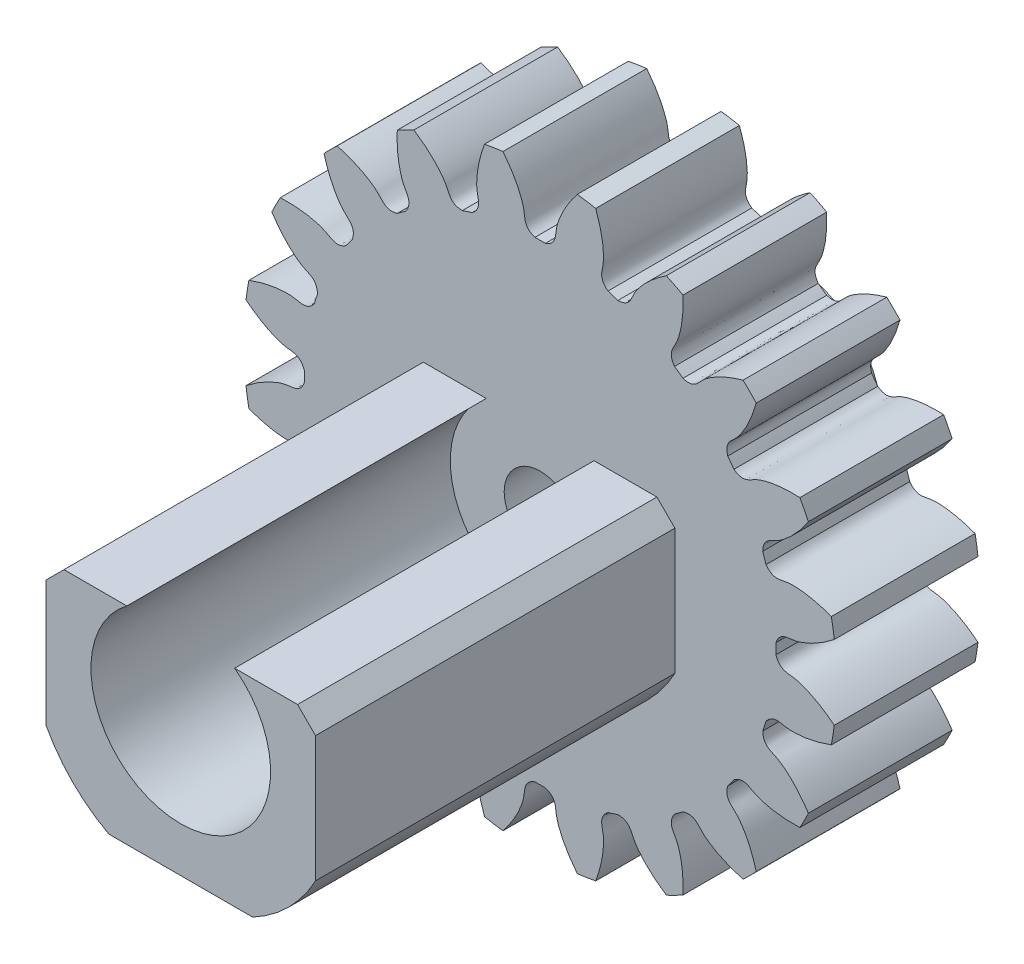
from build123d import *

# Parameters (mm, degrees)
SKETCH_1_R               = 16.5
EXTRUDE_1_DEPTH          = 8
CUT_EXTRUDE_1_DEPTH      = 25.667792767
PATTERN_CIRCULAR_1_COUNT = 20
SKETCH_4_R               = 6
EXTRUDE_2_DEPTH          = 1
SKETCH_5_R               = 5
EXTRUDE_3_DEPTH          = 5
SKETCH_6_R               = 8.5
EXTRUDE_4_DEPTH          = 20
SKETCH_7_R               = 5
CUT_EXTRUDE_2_DEPTH      = 20
SKETCH_8_W               = 20.681346225
SKETCH_8_H               = 7.878608086
CUT_EXTRUDE_3_DEPTH      = 20
CUT_EXTRUDE_START        = -20
CUT_EXTRUDE_4_DEPTH      = 20
CHAMFER_1_SIZE           = 1
SKETCH_10_R              = 1.5
CUT_EXTRUDE_5_DEPTH      = 10
SKETCH_11_R              = 2
CUT_EXTRUDE_6_DEPTH      = 14


with BuildPart() as part:
    # 草图1 → 凸台-拉伸1 (new body)
    with BuildSketch(Plane.XY):
        Circle(SKETCH_1_R)
    extrude(amount=EXTRUDE_1_DEPTH)

    # 草图2 → 切除-拉伸1 (cut, through all)
    with BuildSketch(Plane.XY):
        with BuildLine():
            ThreePointArc((0.289974901, 13.121796354), (0, 13.125), (-0.289974901, 13.121796354))
            add(Edge.make_bspline(
                [(-0.289974901, 13.121796354), (-0.916784107, 13.340213268), (-0.835626149, 13.780670548), (-0.919345585, 14.205014104), (-0.928338279, 14.246334921), (-0.939466335, 14.292951923), (-0.952938145, 14.344795254), (-0.96896871, 14.401787245), (-0.987768083, 14.463844242), (-1.009544807, 14.5308761), (-1.034504625, 14.602786421), (-1.06285065, 14.679472568), (-1.094783098, 14.760825751), (-1.130499153, 14.846731096), (-1.170192797, 14.937067727), (-1.214054647, 15.031708847), (-1.2622718, 15.130521826), (-1.315027675, 15.233368292), (-1.372501858, 15.340104225), (-1.434869948, 15.450580056), (-1.502303414, 15.564640771), (-1.574969439, 15.682126017), (-1.653030782, 15.802870208), (-1.736645634, 15.926702646), (-1.825967477, 16.05344763), (-1.921144951, 16.182924586), (-2.022321721, 16.314948181), (-2.129636342, 16.449328459), (-2.24322214, 16.585870967), (-2.363207078, 16.724376892), (-2.489713645, 16.864643194), (-2.622858733, 17.006462752), (-2.762753527, 17.149624504), (-2.909503389, 17.29391359), (-3.06320776, 17.439111509), (-3.223960048, 17.584996263), (-3.391847534, 17.731342516), (-3.566951278, 17.877921749), (-3.749346018, 18.024502419), (-3.939100102, 18.170850122), (-4.136275349, 18.31672776), (-4.412210386, 18.512459802), (-4.625898619, 18.654498902), (-4.771736973, 18.747377789)],
                knots=[0, 0, 0, 0, 0.165916003, 0.170905922, 0.176663519, 0.183188797, 0.190481754, 0.198542391, 0.207370708, 0.216966704, 0.22733038, 0.238461736, 0.250360771, 0.263027487, 0.276461881, 0.290663956, 0.30563371, 0.321371144, 0.337876258, 0.355149051, 0.373189524, 0.391997677, 0.411573509, 0.431917021, 0.453028213, 0.474907084, 0.497553636, 0.520967867, 0.545149777, 0.570099367, 0.595816637, 0.622301587, 0.649554216, 0.677574526, 0.706362514, 0.735918183, 0.766241531, 0.797332559, 0.829191267, 0.861817654, 0.895211721, 0.929373468, 1, 1, 1, 1], degree=3))
            ThreePointArc((-4.771736973, 18.747377789), (0, 19.345119481), (4.771736973, 18.747377789))
            add(Edge.make_bspline(
                [(0.289974901, 13.121796354), (0.916784107, 13.340213268), (0.835626149, 13.780670548), (0.919345585, 14.205014104), (0.928338279, 14.246334921), (0.939466335, 14.292951923), (0.952938145, 14.344795254), (0.96896871, 14.401787245), (0.987768083, 14.463844242), (1.009544807, 14.5308761), (1.034504625, 14.602786421), (1.06285065, 14.679472568), (1.094783098, 14.760825751), (1.130499153, 14.846731096), (1.170192797, 14.937067727), (1.214054647, 15.031708847), (1.2622718, 15.130521826), (1.315027675, 15.233368292), (1.372501858, 15.340104225), (1.434869948, 15.450580056), (1.502303414, 15.564640771), (1.574969439, 15.682126017), (1.653030782, 15.802870208), (1.736645634, 15.926702646), (1.825967477, 16.05344763), (1.921144951, 16.182924586), (2.022321721, 16.314948181), (2.129636342, 16.449328459), (2.24322214, 16.585870967), (2.363207078, 16.724376892), (2.489713645, 16.864643194), (2.622858733, 17.006462752), (2.762753527, 17.149624504), (2.909503389, 17.29391359), (3.06320776, 17.439111509), (3.223960048, 17.584996263), (3.391847534, 17.731342516), (3.566951278, 17.877921749), (3.749346018, 18.024502419), (3.939100102, 18.170850122), (4.136275349, 18.31672776), (4.412210386, 18.512459802), (4.625898619, 18.654498902), (4.771736973, 18.747377789)],
                knots=[0, 0, 0, 0, 0.165916003, 0.170905922, 0.176663519, 0.183188797, 0.190481754, 0.198542391, 0.207370708, 0.216966704, 0.22733038, 0.238461736, 0.250360771, 0.263027487, 0.276461881, 0.290663956, 0.30563371, 0.321371144, 0.337876258, 0.355149051, 0.373189524, 0.391997677, 0.411573509, 0.431917021, 0.453028213, 0.474907084, 0.497553636, 0.520967867, 0.545149777, 0.570099367, 0.595816637, 0.622301587, 0.649554216, 0.677574526, 0.706362514, 0.735918183, 0.766241531, 0.797332559, 0.829191267, 0.861817654, 0.895211721, 0.929373468, 1, 1, 1, 1], degree=3))
        make_face()
    cut_extrude_1 = extrude(amount=CUT_EXTRUDE_1_DEPTH, mode=Mode.SUBTRACT)

    # 阵列(圆周)1: 切除-拉伸1 ×20 about axis
    pattern_circular_1_axis = Axis((0, 0, 8), (0, 0, -1))
    for i in range(1, PATTERN_CIRCULAR_1_COUNT):
        add(cut_extrude_1.rotate(pattern_circular_1_axis, i * 360 / PATTERN_CIRCULAR_1_COUNT), mode=Mode.SUBTRACT)

    # 草图4 → 凸台-拉伸2 (add)
    with BuildSketch(Plane(origin=(0, 0, 0), x_dir=(-1, 0, 0), z_dir=(0, 0, -1))):
        with Locations(Location((0, 0, 0), (0, 0, 180))):
            Circle(SKETCH_4_R)
    extrude(amount=EXTRUDE_2_DEPTH)

    # 草图5 → 凸台-拉伸3 (add)
    with BuildSketch(Plane(origin=(0, 0, -1), x_dir=(-1, 0, 0), z_dir=(0, 0, -1))):
        Circle(SKETCH_5_R)
    extrude(amount=EXTRUDE_3_DEPTH)

    # 草图6 → 凸台-拉伸4 (add)
    with BuildSketch(Plane.XY.offset(8)):
        Circle(SKETCH_6_R)
    extrude(amount=EXTRUDE_4_DEPTH)

    # 草图7 → 切除-拉伸2 (cut)
    with BuildSketch(Plane.XY.offset(28)):
        with Locations(Location((0, 0, 0), (0, 0, 180))):
            Circle(SKETCH_7_R)
    extrude(amount=-CUT_EXTRUDE_2_DEPTH, mode=Mode.SUBTRACT)

    # 草图8 → 切除-拉伸3 (cut)
    with BuildSketch(Plane.XY.offset(28)):
        with Locations((1.237163556, 7.939304043)):
            Rectangle(SKETCH_8_W, SKETCH_8_H)
    extrude(amount=-CUT_EXTRUDE_3_DEPTH, mode=Mode.SUBTRACT)

    # 草图9 → 切除-拉伸4 (cut)
    with BuildSketch(Plane.XY.offset(28).offset(CUT_EXTRUDE_START)):
        with BuildLine():
            Line((-7.5, 4), (-7.5, -4))
            ThreePointArc((-7.5, -4), (-8.5, 0), (-7.5, 4))
        make_face()
        with BuildLine():
            Line((-4, -7.5), (4, -7.5))
            ThreePointArc((4, -7.5), (0, -8.5), (-4, -7.5))
        make_face()
        with BuildLine():
            Line((7.5, 4), (7.5, -4))
            ThreePointArc((7.5, -4), (8.5, 0), (7.5, 4))
        make_face()
    extrude(amount=CUT_EXTRUDE_4_DEPTH, mode=Mode.SUBTRACT)

    # 倒角1
    chamfer_1_edges = [part.edges().sort_by_distance(p)[0] for p in [
        (-7.5, 4, 18),
        (7.5, 4, 18),
    ]]
    chamfer(chamfer_1_edges, length=CHAMFER_1_SIZE)

    # 草图10 → 切除-拉伸5 (cut)
    with BuildSketch(Plane.XZ.offset(7.5)):
        with Locations(Location((0, 18, 0), (0, 0, 270))):
            Circle(SKETCH_10_R)
    extrude(amount=-CUT_EXTRUDE_5_DEPTH, mode=Mode.SUBTRACT)

    # 草图11 → 切除-拉伸6 (cut)
    with BuildSketch(Plane(origin=(0, 0, -6), x_dir=(-1, 0, 0), z_dir=(0, 0, -1))):
        Circle(SKETCH_11_R)
    extrude(amount=-CUT_EXTRUDE_6_DEPTH, mode=Mode.SUBTRACT)


solid = part.part
